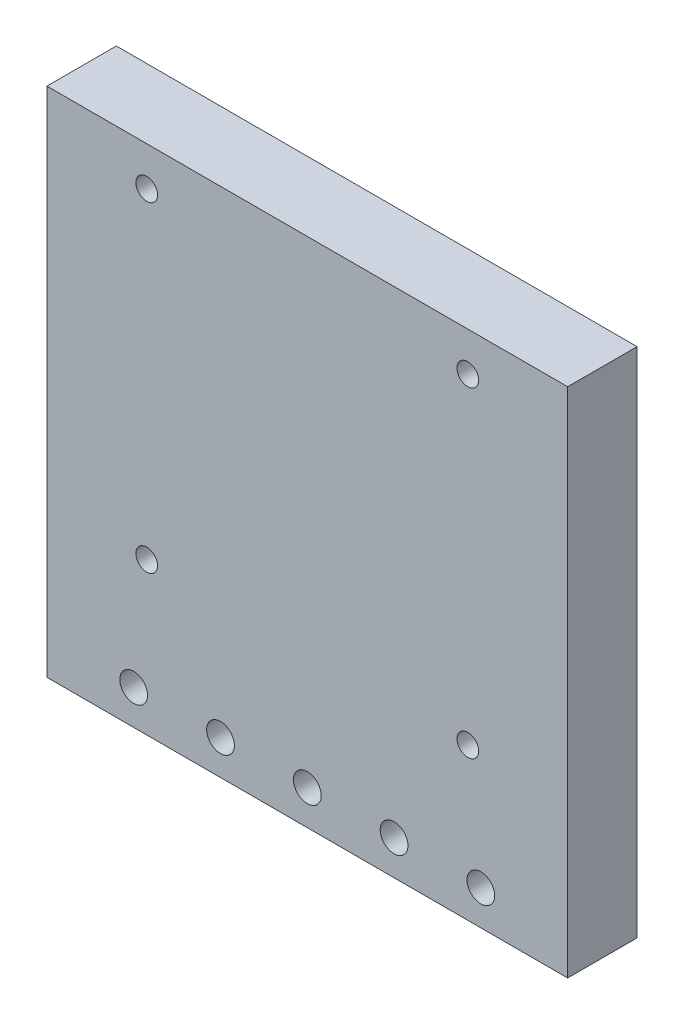
from build123d import *

# Parameters (mm, degrees)
SKETCH_1_W          = 60
SKETCH_1_H          = 59
EXTRUDE_1_DEPTH     = 8
SKETCH_2_R          = 1.25
CUT_EXTRUDE_1_DEPTH = 8
SKETCH_3_R          = 1.6
CUT_EXTRUDE_2_DEPTH = 85.528101836


with BuildPart() as part:
    # 草图1 → 凸台-拉伸1 (new body)
    with BuildSketch(Plane.XY):
        with Locations((30, -29.5)):
            Rectangle(SKETCH_1_W, SKETCH_1_H)
    extrude(amount=EXTRUDE_1_DEPTH)

    # 草图2 → 切除-拉伸1 (cut)
    with BuildSketch(Plane.XY.offset(8)):
        with Locations((11.5, -4.5)):
            Circle(SKETCH_2_R)
        with Locations((48.5, -4.5)):
            Circle(SKETCH_2_R)
        with Locations((11.5, -41.5)):
            Circle(SKETCH_2_R)
        with Locations((48.5, -41.5)):
            Circle(SKETCH_2_R)
    extrude(amount=-CUT_EXTRUDE_1_DEPTH, mode=Mode.SUBTRACT)

    # 草图3 → 切除-拉伸2 (cut, through all)
    with BuildSketch(Plane.XY.offset(8)):
        with Locations((10, -55)):
            Circle(SKETCH_3_R)
        with Locations((20, -55)):
            Circle(SKETCH_3_R)
        with Locations((30, -55)):
            Circle(SKETCH_3_R)
        with Locations((40, -55)):
            Circle(SKETCH_3_R)
        with Locations((50, -55)):
            Circle(SKETCH_3_R)
    extrude(amount=-CUT_EXTRUDE_2_DEPTH, mode=Mode.SUBTRACT)


solid = part.part
